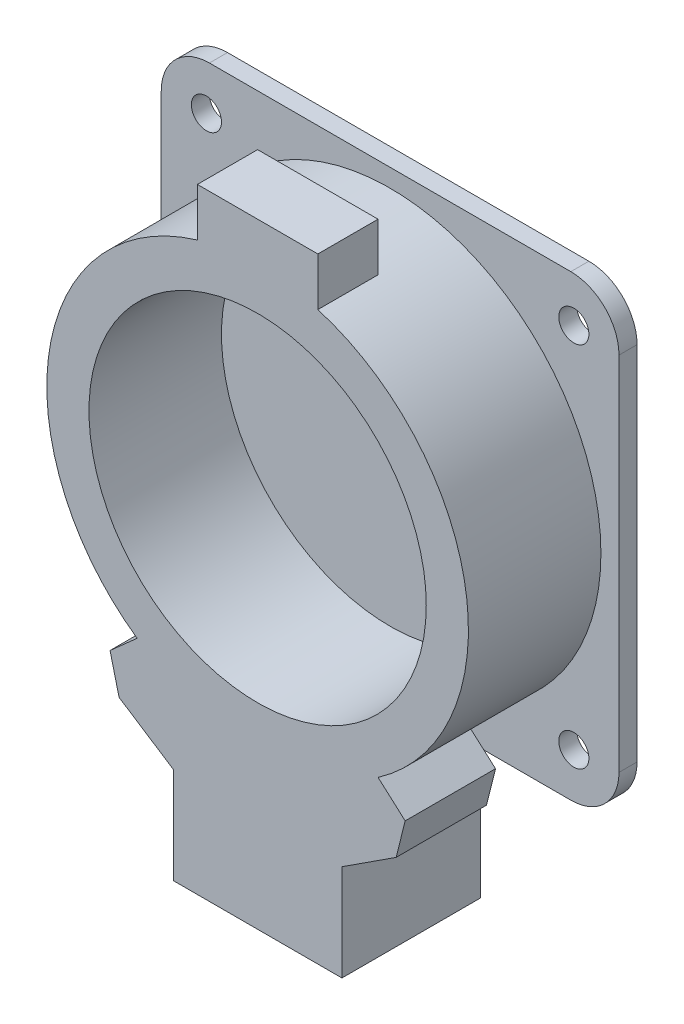
from build123d import *

# Parameters (mm, degrees)
PRINT_2_DEPTH        = 1.5
PRINT_HOLES_REACH    = 28.912
SKETCH1_4_R          = 1.25
SKETCH1_5_R          = 1.75
SCREWS_DEPTH         = 3
SKETCH1_6_W          = 21
SKETCH1_6_H          = 5.5
CABLECONNECTOR_DEPTH = 3
CAM_START            = 1.5
CAM_BASE_DEPTH       = 11
BASE_START           = 12.5
SKETCH1_8_W          = 10
SKETCH1_8_H          = 4
BASE_CLAMP_DEPTH     = 5
BOSS_EXTRUDE6_START  = 5
BOSS_EXTRUDE6_DEPTH  = 7.5
BOSS_EXTRUDE7_START  = 12.5
SKETCH1_10_W         = 14
SKETCH1_10_H         = 8
SKETCH1_10_H_2       = 3
BOSS_EXTRUDE7_DEPTH  = 11.5


with BuildPart() as part:
    # Sketch1 → print 2 (new body)
    with BuildSketch(Plane.XY):
        with BuildLine():
            Line((-15, -19), (15, -19))
            ThreePointArc((15, -19), (17.828427125, -17.828427125), (19, -15))
            Line((19, -15), (19, 15))
            ThreePointArc((19, 15), (17.828427125, 17.828427125), (15, 19))
            Line((15, 19), (-15, 19))
            ThreePointArc((-15, 19), (-17.828427125, 17.828427125), (-19, 15))
            Line((-19, 15), (-19, -15))
            ThreePointArc((-19, -15), (-17.828427125, -17.828427125), (-15, -19))
        make_face()
    extrude(amount=PRINT_2_DEPTH)

    # Sketch1<4> → print_holes (cut, up to next)
    with BuildSketch(Plane.XY, mode=Mode.PRIVATE) as print_holes_sk1:
        with Locations((-15.25, 15.25)):
            Circle(SKETCH1_4_R)
    print_holes_tool1 = extrude(print_holes_sk1.sketch, amount=PRINT_HOLES_REACH, mode=Mode.PRIVATE) & part.part
    # Sketch1<4> → print_holes (cut, up to next)
    with BuildSketch(Plane.XY, mode=Mode.PRIVATE) as print_holes_sk2:
        with Locations((-15.25, -15.25)):
            Circle(SKETCH1_4_R)
    print_holes_tool2 = extrude(print_holes_sk2.sketch, amount=PRINT_HOLES_REACH, mode=Mode.PRIVATE) & part.part
    # Sketch1<4> → print_holes (cut, up to next)
    with BuildSketch(Plane.XY, mode=Mode.PRIVATE) as print_holes_sk3:
        with Locations((15.25, -15.25)):
            Circle(SKETCH1_4_R)
    print_holes_tool3 = extrude(print_holes_sk3.sketch, amount=PRINT_HOLES_REACH, mode=Mode.PRIVATE) & part.part
    # Sketch1<4> → print_holes (cut, up to next)
    with BuildSketch(Plane.XY, mode=Mode.PRIVATE) as print_holes_sk4:
        with Locations((15.25, 15.25)):
            Circle(SKETCH1_4_R)
    print_holes_tool4 = extrude(print_holes_sk4.sketch, amount=PRINT_HOLES_REACH, mode=Mode.PRIVATE) & part.part
    add(print_holes_tool1.solids().sort_by_distance((-15.25, 15.25, 0))[0], mode=Mode.SUBTRACT)
    add(print_holes_tool2.solids().sort_by_distance((-15.25, -15.25, 0))[0], mode=Mode.SUBTRACT)
    add(print_holes_tool3.solids().sort_by_distance((15.25, -15.25, 0))[0], mode=Mode.SUBTRACT)
    add(print_holes_tool4.solids().sort_by_distance((15.25, 15.25, 0))[0], mode=Mode.SUBTRACT)

    # Sketch1<5> → screws (add)
    with BuildSketch(Plane.XY):
        with Locations((-12.25, 0)):
            Circle(SKETCH1_5_R)
        with Locations((12.25, 0)):
            Circle(SKETCH1_5_R)
    extrude(amount=-SCREWS_DEPTH)

    # Sketch1<6> → cableconnector (add)
    with BuildSketch(Plane.XY):
        with Locations((0, -16.25)):
            Rectangle(SKETCH1_6_W, SKETCH1_6_H)
    extrude(amount=-CABLECONNECTOR_DEPTH)

    # Sketch1<7> → cam base (add)
    with BuildSketch(Plane.XY.offset(CAM_START)):
        with BuildLine():
            ThreePointArc((-5, 16.770509831), (-17.226972131, 3.079193268), (-10.5, -14))
            Line((-10.5, -14), (-10.5, -13.5))
            Line((-10.5, -13.5), (-3.708099244, -13.5))
            ThreePointArc((-3.708099244, -13.5), (-11.133584092, -8.487832778), (-14, 5e-09))
            ThreePointArc((-14, 5e-09), (2e-09, 14), (14, 0))
            ThreePointArc((14, 0), (11.133584091, -8.48783278), (3.708099244, -13.5))
            Line((3.708099244, -13.5), (10.5, -13.5))
            Line((10.5, -13.5), (10.5, -14))
            ThreePointArc((10.5, -14), (15.652475842, -7.826237921), (17.5, 0))
            ThreePointArc((17.5, 0), (14.0312152, 10.458250332), (5, 16.770509831))
            Line((5, 16.770509831), (-5, 16.770509831))
        make_face()
        with BuildLine():
            Line((-10.5, -13.5), (-10.5, -14))
            ThreePointArc((-10.5, -14), (-10.251592739, -14.182906836), (-10, -14.361406616))
            ThreePointArc((-10, -14.361406616), (0, -17.5), (10, -14.361406616))
            ThreePointArc((10, -14.361406616), (10.251592739, -14.182906836), (10.5, -14))
            Line((10.5, -14), (10.5, -13.5))
            Line((10.5, -13.5), (3.708099244, -13.5))
            ThreePointArc((3.708099244, -13.5), (0, -14), (-3.708099244, -13.5))
            Line((-3.708099244, -13.5), (-10.5, -13.5))
        make_face()
        with BuildLine():
            ThreePointArc((5, 16.770509831), (0, 17.5), (-5, 16.770509831))
            Line((-5, 16.770509831), (5, 16.770509831))
        make_face()
    extrude(amount=CAM_BASE_DEPTH)

    # Sketch1<8> → base clamp (add)
    with BuildSketch(Plane.XY.offset(BASE_START)):
        with Locations((0, 18.770509831)):
            Rectangle(SKETCH1_8_W, SKETCH1_8_H)
    extrude(amount=-BASE_CLAMP_DEPTH)

    # Sketch1<9> → Boss-Extrude6 (add)
    with BuildSketch(Plane.XY.offset(BOSS_EXTRUDE6_START)):
        with BuildLine():
            Line((-11.5, -19.361406616), (-7, -22.283740786))
            Line((-7, -22.283740786), (-7, -19.283740786))
            Line((-7, -19.283740786), (7, -19.283740786))
            Line((7, -19.283740786), (7, -22.283740786))
            Line((7, -22.283740786), (11.5, -19.361406616))
            Line((11.5, -19.361406616), (12.25, -16.361406616))
            Line((12.25, -16.361406616), (10, -14.361406616))
            ThreePointArc((10, -14.361406616), (0, -17.5), (-10, -14.361406616))
            Line((-10, -14.361406616), (-12.25, -16.361406616))
            Line((-12.25, -16.361406616), (-11.5, -19.361406616))
        make_face()
    extrude(amount=BOSS_EXTRUDE6_DEPTH)

    # Sketch1<10> → Boss-Extrude7 (add)
    with BuildSketch(Plane.XY.offset(BOSS_EXTRUDE7_START)):
        with Locations((0, -26.283740786)):
            Rectangle(SKETCH1_10_W, SKETCH1_10_H)
        with Locations((0, -20.783740786)):
            Rectangle(SKETCH1_10_W, SKETCH1_10_H_2)
    extrude(amount=-BOSS_EXTRUDE7_DEPTH)


solid = part.part
